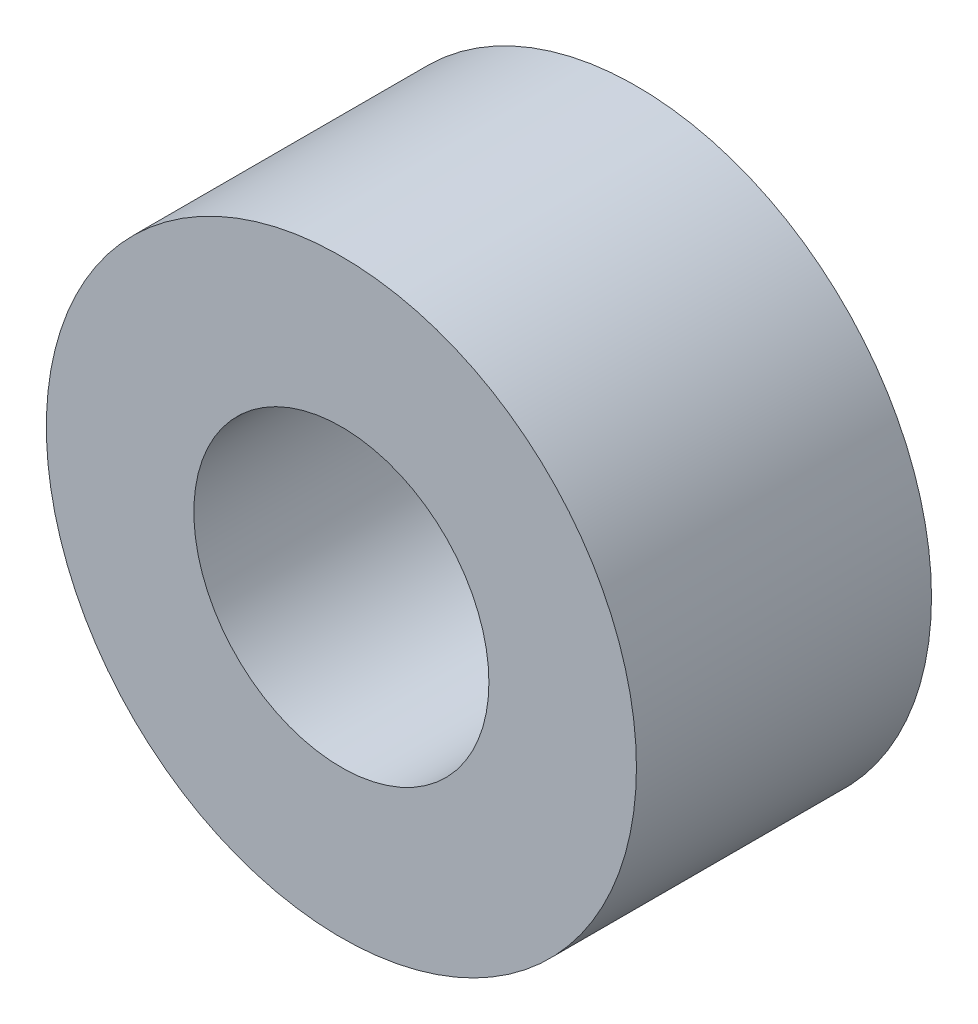
from build123d import *

# Parameters (mm, degrees)
SKETCH1_R           = 6
SKETCH1_R_2         = 3
BOSS_EXTRUDE1_DEPTH = 6


with BuildPart() as part:
    # Sketch1 → Boss-Extrude1 (new body)
    with BuildSketch(Plane.XY):
        Circle(SKETCH1_R)
        Circle(SKETCH1_R_2, mode=Mode.SUBTRACT)
    extrude(amount=BOSS_EXTRUDE1_DEPTH)


solid = part.part
